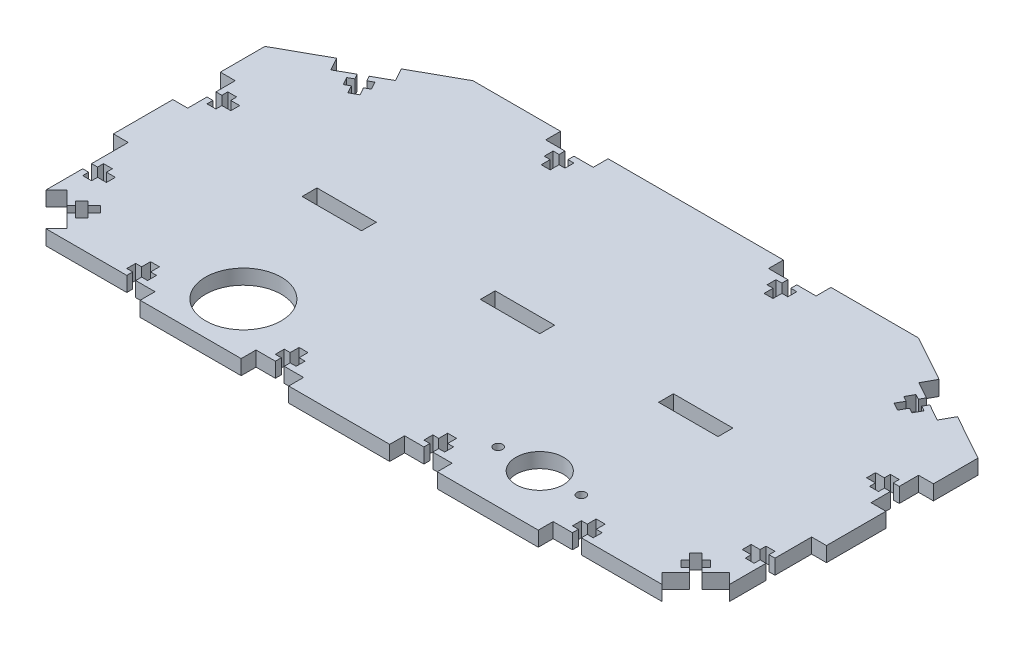
from build123d import *

# Parameters (mm, degrees)
CROQUIS1_W              = 200
CROQUIS1_H              = 120
SALIENTE_EXTRUIR1_DEPTH = 5
CROQUIS2_W              = 16
CROQUIS2_H              = 5
CORTAR_EXTRUIR1_DEPTH   = 117.726175299
CROQUIS3_W              = 3
CROQUIS3_H              = 8
CROQUIS3_W_2            = 2
CROQUIS3_H_2            = 3
CROQUIS3_H_3            = 2
CORTAR_EXTRUIR2_DEPTH   = 10
SALIENTE_EXTRUIR2_DEPTH = 5
CORTAR_EXTRUIR7_DEPTH   = 145.308696897
CROQUIS8_W              = 16
CROQUIS8_H              = 5
CORTAR_EXTRUIR8_DEPTH   = 5.93
CORTAR_EXTRUIR10_DEPTH  = 5
CROQUIS10_W             = 5
CROQUIS10_H             = 16
CROQUIS10_H_2           = 30
CORTAR_EXTRUIR11_DEPTH  = 135.257215821
CROQUIS11_W             = 3
CROQUIS11_H             = 3
CROQUIS11_H_2           = 2
CROQUIS11_W_2           = 2
CORTAR_EXTRUIR12_DEPTH  = 135.257215821
CORTAR_EXTRUIR13_DEPTH  = 135.257215821
CROQUIS15_R             = 12.75
CROQUIS15_R_2           = 8
CORTAR_EXTRUIR15_DEPTH  = 135.257215821
CROQUIS17_W             = 240
CROQUIS17_H             = 30
SALIENTE_EXTRUIR3_DEPTH = 5
CORTAR_EXTRUIR18_DEPTH  = 135.257215821
CORTAR_EXTRUIR19_DEPTH  = 135.257215821
CROQUIS20_W             = 16
CROQUIS20_H             = 10
CROQUIS20_W_2           = 3
CROQUIS20_H_2           = 16
CROQUIS20_W_3           = 7
CROQUIS20_H_3           = 3
CORTAR_EXTRUIR20_DEPTH  = 135.257215821
CROQUIS24_W             = 20
CROQUIS24_H             = 5
CORTAR_EXTRUIR25_DEPTH  = 135.257215821
CROQUIS25_W             = 20
CROQUIS25_H             = 5
CORTAR_EXTRUIR26_DEPTH  = 135.257215821
CROQUIS26_R             = 1.5
CORTAR_EXTRUIR28_DEPTH  = 135.257215821


with BuildPart() as part:
    # Croquis1 → Saliente-Extruir1 (new body)
    with BuildSketch(Plane(origin=(0, 0, 0), x_dir=(1, 0, 0), z_dir=(0, 1, 0))):
        Rectangle(CROQUIS1_W, CROQUIS1_H)
    extrude(amount=SALIENTE_EXTRUIR1_DEPTH)

    # Croquis2 → Cortar-Extruir1 (cut, through all)
    with BuildSketch(Plane(origin=(0, 5, 0), x_dir=(1, 0, 0), z_dir=(0, 1, 0))):
        with Locations((-75, -57.5)):
            Rectangle(CROQUIS2_W, CROQUIS2_H)
        with Locations((-25, -57.5)):
            Rectangle(CROQUIS2_W, CROQUIS2_H)
    cortar_extruir1 = extrude(amount=-CORTAR_EXTRUIR1_DEPTH, mode=Mode.SUBTRACT)

    # Simetría1: Cortar-Extruir1 across plane
    add(cortar_extruir1.mirror(Plane(origin=(0, 0, 0), x_dir=(0, 0, 1), z_dir=(1, 0, 0))), mode=Mode.SUBTRACT)

    # Croquis3 → Cortar-Extruir2 (cut)
    with BuildSketch(Plane(origin=(0, 5, 0), x_dir=(1, 0, 0), z_dir=(0, 1, 0))):
        with Locations((-75, -59)):
            Rectangle(CROQUIS3_W, CROQUIS3_H)
        with Locations((-77.5, -51.5)):
            Rectangle(CROQUIS3_W_2, CROQUIS3_H_2)
        with Locations((-72.5, -51.5)):
            Rectangle(CROQUIS3_W_2, CROQUIS3_H_2)
        with Locations((-75, -54)):
            Rectangle(CROQUIS3_W, CROQUIS3_H_3)
        with Locations((-75, -48.5)):
            Rectangle(CROQUIS3_W, CROQUIS3_H_2)
        with Locations((-75, -51.5)):
            Rectangle(CROQUIS3_W, CROQUIS3_H_2)
        with Locations((-25, -48.5)):
            Rectangle(CROQUIS3_W, CROQUIS3_H_2)
        with Locations((-22.5, -51.5)):
            Rectangle(CROQUIS3_W_2, CROQUIS3_H_2)
        with Locations((-25, -51.5)):
            Rectangle(CROQUIS3_W, CROQUIS3_H_2)
        with Locations((-27.5, -51.5)):
            Rectangle(CROQUIS3_W_2, CROQUIS3_H_2)
        with Locations((-25, -59)):
            Rectangle(CROQUIS3_W, CROQUIS3_H)
        with Locations((-25, -54)):
            Rectangle(CROQUIS3_W, CROQUIS3_H_3)
    cortar_extruir2 = extrude(amount=-CORTAR_EXTRUIR2_DEPTH, mode=Mode.SUBTRACT)

    # Simetría2: Cortar-Extruir2 across plane
    add(cortar_extruir2.mirror(Plane(origin=(0, 0, 0), x_dir=(0, 0, 1), z_dir=(1, 0, 0))), mode=Mode.SUBTRACT)

    # Croquis4 → Saliente-Extruir2 (add)
    with BuildSketch(Plane(origin=(0, 5, 0), x_dir=(1, 0, 0), z_dir=(0, 1, 0))):
        Polygon((-100, 60), (-120, 80), (-120, -40), (-100, -60), align=None)
    saliente_extruir2 = extrude(amount=-SALIENTE_EXTRUIR2_DEPTH)

    # Simetría4: Saliente-Extruir2 across plane
    add(saliente_extruir2.mirror(Plane(origin=(0, 0, 0), x_dir=(0, 0, 1), z_dir=(1, 0, 0))))

    # Croquis6 → Cortar-Extruir7 (cut, through all)
    with BuildSketch(Plane(origin=(0, 5, 0), x_dir=(1, 0, 0), z_dir=(0, 1, 0))):
        Polygon((-120, 80), (-120, 30), (120, 30), (120, 80), (100, 60), (-100, 60), align=None)
    extrude(amount=-CORTAR_EXTRUIR7_DEPTH, mode=Mode.SUBTRACT)

    # Croquis8 → Cortar-Extruir8 (cut)
    with BuildSketch(Plane(origin=(-80, 0, 80), x_dir=(0.7071067811865465, 0, 0.7071067811865486), z_dir=(-0.7071067811865486, 0, 0.7071067811865465))):
        with Locations((-42.428542495, 2.5)):
            Rectangle(CROQUIS8_W, CROQUIS8_H)
    cortar_extruir8 = extrude(amount=-CORTAR_EXTRUIR8_DEPTH, mode=Mode.SUBTRACT)

    # Croquis9 → Cortar-Extruir10 (cut)
    with BuildSketch(Plane(origin=(0, 5, 0), x_dir=(1, 0, 0), z_dir=(0, 1, 0))):
        Polygon((-106.869027073, -44.744686502), (-101.212172824, -39.087832252), (-99.09085248, -41.209152596), (-104.74770673, -46.866006845), align=None)
        Polygon((-106.869027073, -41.916259377), (-101.919279605, -46.866006845), (-99.797959262, -44.744686502), (-104.74770673, -39.794939033), align=None)
    cortar_extruir10 = extrude(amount=-CORTAR_EXTRUIR10_DEPTH, mode=Mode.SUBTRACT)

    # Simetría5: Cortar-Extruir8, Cortar-Extruir10 across plane
    add(cortar_extruir8.mirror(Plane(origin=(0, 0, 0), x_dir=(0, 0, 1), z_dir=(1, 0, 0))), mode=Mode.SUBTRACT)
    add(cortar_extruir10.mirror(Plane(origin=(0, 0, 0), x_dir=(0, 0, 1), z_dir=(1, 0, 0))), mode=Mode.SUBTRACT)

    # Croquis10 → Cortar-Extruir11 (cut, through all)
    with BuildSketch(Plane(origin=(0, 5, 0), x_dir=(1, 0, 0), z_dir=(0, 1, 0))):
        with Locations((-117.5, 12)):
            Rectangle(CROQUIS10_W, CROQUIS10_H)
        with Locations((-117.5, -31)):
            Rectangle(CROQUIS10_W, CROQUIS10_H_2)
    cortar_extruir11 = extrude(amount=-CORTAR_EXTRUIR11_DEPTH, mode=Mode.SUBTRACT)

    # Croquis11 → Cortar-Extruir12 (cut, through all)
    with BuildSketch(Plane(origin=(0, 5, 0), x_dir=(1, 0, 0), z_dir=(0, 1, 0))):
        with Locations((-108.5, 12)):
            Rectangle(CROQUIS11_W, CROQUIS11_H)
        with Locations((-111.5, 12)):
            Rectangle(CROQUIS11_W, CROQUIS11_H)
        with Locations((-111.5, 9.5)):
            Rectangle(CROQUIS11_W, CROQUIS11_H_2)
        with Locations((-114, 12)):
            Rectangle(CROQUIS11_W_2, CROQUIS11_H)
        with Locations((-111.5, 14.5)):
            Rectangle(CROQUIS11_W, CROQUIS11_H_2)
        with Locations((-111.5, -29.841635636)):
            Rectangle(CROQUIS11_W, CROQUIS11_H)
        with Locations((-111.5, -32.341635636)):
            Rectangle(CROQUIS11_W, CROQUIS11_H_2)
        with Locations((-108.5, -29.841635636)):
            Rectangle(CROQUIS11_W, CROQUIS11_H)
        with Locations((-111.5, -27.341635636)):
            Rectangle(CROQUIS11_W, CROQUIS11_H_2)
        with Locations((-114, -29.841635636)):
            Rectangle(CROQUIS11_W_2, CROQUIS11_H)
    cortar_extruir12 = extrude(amount=-CORTAR_EXTRUIR12_DEPTH, mode=Mode.SUBTRACT)

    # Simetría6: Cortar-Extruir11, Cortar-Extruir12 across plane
    add(cortar_extruir11.mirror(Plane(origin=(0, 0, 0), x_dir=(0, 0, 1), z_dir=(1, 0, 0))), mode=Mode.SUBTRACT)
    add(cortar_extruir12.mirror(Plane(origin=(0, 0, 0), x_dir=(0, 0, 1), z_dir=(1, 0, 0))), mode=Mode.SUBTRACT)

    # Croquis12 → Cortar-Extruir13 (cut, through all)
    with BuildSketch(Plane(origin=(0, 5, 0), x_dir=(1, 0, 0), z_dir=(0, 1, 0))):
        Polygon((-83, -55), (-83, -60), (-100, -60), (-104.344655865, -55.655344135), (-103.689311729, -55), align=None)
    cortar_extruir13 = extrude(amount=-CORTAR_EXTRUIR13_DEPTH, mode=Mode.SUBTRACT)

    # Simetría7: Cortar-Extruir13 across plane
    add(cortar_extruir13.mirror(Plane(origin=(0, 0, 0), x_dir=(0, 0, 1), z_dir=(1, 0, 0))), mode=Mode.SUBTRACT)

    # Croquis15 → Cortar-Extruir15 (cut, through all)
    with BuildSketch(Plane(origin=(0, 5, 0), x_dir=(1, 0, 0), z_dir=(0, 1, 0))):
        with Locations(Location((-50, -42.25, 0), (0, 0, 270))):
            Circle(CROQUIS15_R)
        with Locations(Location((50, -42.5, 0), (0, 0, 270))):
            Circle(CROQUIS15_R_2)
    extrude(amount=-CORTAR_EXTRUIR15_DEPTH, mode=Mode.SUBTRACT)

    # Croquis17 → Saliente-Extruir3 (add)
    with BuildSketch(Plane(origin=(0, 5, 0), x_dir=(1, 0, 0), z_dir=(0, 1, 0))):
        with Locations((0, 45)):
            Rectangle(CROQUIS17_W, CROQUIS17_H)
    extrude(amount=-SALIENTE_EXTRUIR3_DEPTH)

    # Croquis18 → Cortar-Extruir18 (cut, through all)
    with BuildSketch(Plane(origin=(0, 5, 0), x_dir=(1, 0, 0), z_dir=(0, 1, 0))):
        Polygon((-75, 60), (-120, 35), (-120, 60), align=None)
    cortar_extruir18 = extrude(amount=-CORTAR_EXTRUIR18_DEPTH, mode=Mode.SUBTRACT)

    # Simetría8: Cortar-Extruir18 across plane
    add(cortar_extruir18.mirror(Plane(origin=(0, 0, 0), x_dir=(0, 0, 1), z_dir=(1, 0, 0))), mode=Mode.SUBTRACT)

    # Croquis19 → Cortar-Extruir19 (cut, through all)
    with BuildSketch(Plane(origin=(0, 5, 0), x_dir=(1, 0, 0), z_dir=(0, 1, 0))):
        Polygon((-102.065043553, 39.24407017), (-96.383021258, 42.400749223), (-95.411735396, 40.65243467), (-97.160049948, 39.681148808), (-95.703121155, 37.05867698), (-93.954806602, 38.029962842), (-92.497877809, 35.407491014), (-89.87540598, 36.864419807), (-91.332334774, 39.486891636), (-89.584020222, 40.458177498), (-91.040949015, 43.080649326), (-92.789263568, 42.109363464), (-93.76054943, 43.857678016), (-88.078527135, 47.014357069), (-90.506741791, 51.385143449), (-104.493258209, 43.614856551), align=None)
    cortar_extruir19 = extrude(amount=-CORTAR_EXTRUIR19_DEPTH, mode=Mode.SUBTRACT)

    # Simetría9: Cortar-Extruir19 across plane
    add(cortar_extruir19.mirror(Plane(origin=(0, 0, 0), x_dir=(0, 0, 1), z_dir=(1, 0, 0))), mode=Mode.SUBTRACT)

    # Croquis20 → Cortar-Extruir20 (cut, through all)
    with BuildSketch(Plane(origin=(0, 5, 0), x_dir=(1, 0, 0), z_dir=(0, 1, 0))):
        with Locations((-37.5, 60)):
            Rectangle(CROQUIS20_W, CROQUIS20_H)
        with Locations((-37.5, 55)):
            Rectangle(CROQUIS20_W_2, CROQUIS20_H_2)
        with Locations((-37.5, 51.5)):
            Rectangle(CROQUIS20_W_3, CROQUIS20_H_3)
    cortar_extruir20 = extrude(amount=-CORTAR_EXTRUIR20_DEPTH, mode=Mode.SUBTRACT)

    # Simetría10: Cortar-Extruir20 across plane
    add(cortar_extruir20.mirror(Plane(origin=(0, 0, 0), x_dir=(0, 0, 1), z_dir=(1, 0, 0))), mode=Mode.SUBTRACT)

    # Croquis24 → Cortar-Extruir25 (cut, through all)
    with BuildSketch(Plane(origin=(0, 5, 0), x_dir=(1, 0, 0), z_dir=(0, 1, 0))):
        with Locations((-60, 0)):
            Rectangle(CROQUIS24_W, CROQUIS24_H)
    cortar_extruir25 = extrude(amount=-CORTAR_EXTRUIR25_DEPTH, mode=Mode.SUBTRACT)

    # Simetría11: Cortar-Extruir25 across plane
    add(cortar_extruir25.mirror(Plane(origin=(0, 0, 0), x_dir=(0, 0, 1), z_dir=(1, 0, 0))), mode=Mode.SUBTRACT)

    # Croquis25 → Cortar-Extruir26 (cut, through all)
    with BuildSketch(Plane(origin=(0, 5, 0), x_dir=(1, 0, 0), z_dir=(0, 1, 0))):
        Rectangle(CROQUIS25_W, CROQUIS25_H)
    extrude(amount=-CORTAR_EXTRUIR26_DEPTH, mode=Mode.SUBTRACT)

    # Croquis26 → Cortar-Extruir28 (cut, through all)
    with BuildSketch(Plane(origin=(0, 5, 0), x_dir=(1, 0, 0), z_dir=(0, 1, 0))):
        with Locations(Location((36, -42.5, 0), (0, 0, 270))):
            Circle(CROQUIS26_R)
        with Locations(Location((64, -42.5, 0), (0, 0, 270))):
            Circle(CROQUIS26_R)
    extrude(amount=-CORTAR_EXTRUIR28_DEPTH, mode=Mode.SUBTRACT)


solid = part.part
